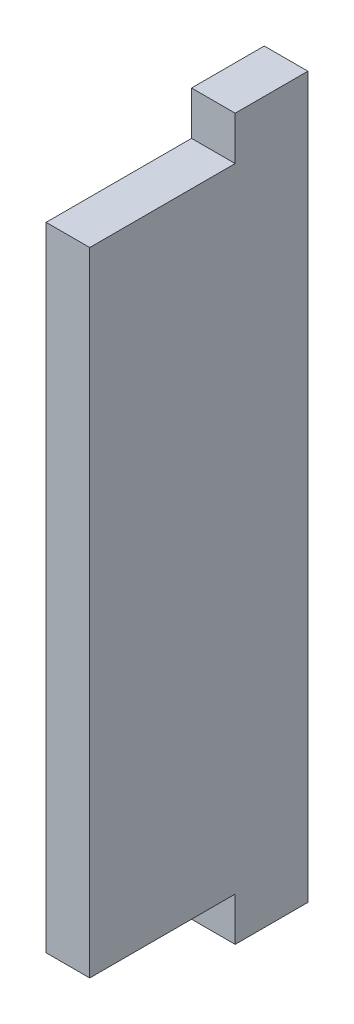
from build123d import *

# Parameters (mm, degrees)
SKETCH1_W           = 15
SKETCH1_H           = 49.5
BOSS_EXTRUDE1_DEPTH = 3
SKETCH2_W           = 10
SKETCH2_H           = 3
CUT_EXTRUDE1_DEPTH  = 27.034832437


with BuildPart() as part:
    # Sketch1 → Boss-Extrude1 (new body)
    with BuildSketch(Plane(origin=(0, 0, 0), x_dir=(0, 0, -1), z_dir=(1, 0, 0))):
        Rectangle(SKETCH1_W, SKETCH1_H)
    extrude(amount=BOSS_EXTRUDE1_DEPTH)

    # Sketch2 → Cut-Extrude1 (cut, through all)
    with BuildSketch(Plane(origin=(3, 0, 0), x_dir=(0, 0, -1), z_dir=(1, 0, 0))):
        with Locations((-2.5, 23.25)):
            Rectangle(SKETCH2_W, SKETCH2_H)
        with Locations((-2.5, -23.25)):
            Rectangle(SKETCH2_W, SKETCH2_H)
    extrude(amount=-CUT_EXTRUDE1_DEPTH, mode=Mode.SUBTRACT)


solid = part.part
